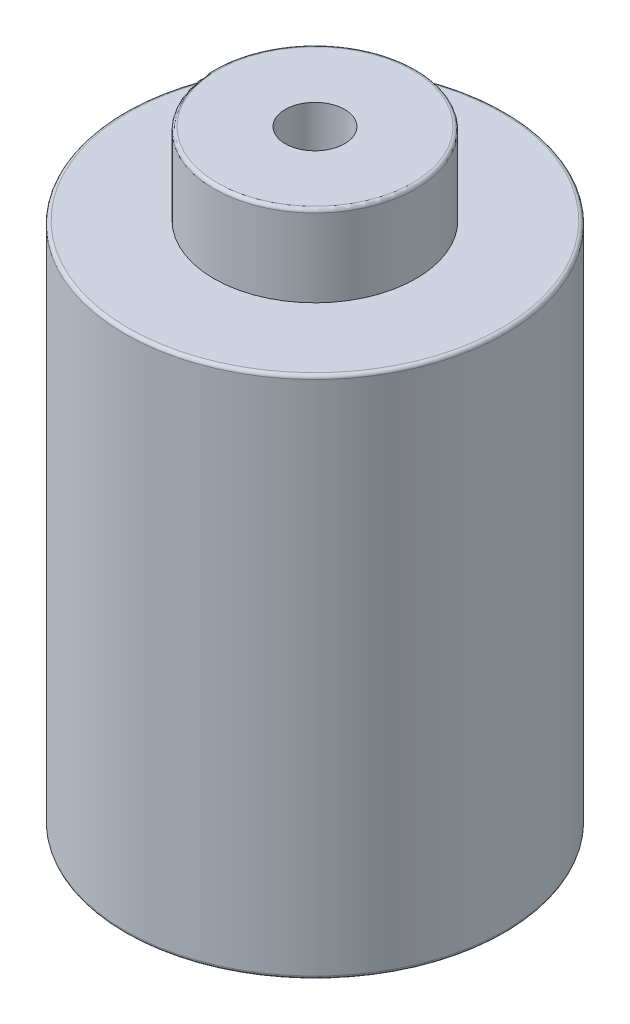
from build123d import *

# Parameters (mm, degrees)
SKETCH1_R           = 13.97
SKETCH1_R_2         = 2.1844
BOSS_EXTRUDE1_DEPTH = 44.45
CUT_EXTRUDE1_START  = -5.969
SKETCH2_R           = 13.97
SKETCH2_R_2         = 7.4295
CUT_EXTRUDE1_DEPTH  = 5.969
FILLET1_R           = 0.254


with BuildPart() as part:
    # Sketch1 → Boss-Extrude1 (new body)
    with BuildSketch(Plane(origin=(0, 0, 0), x_dir=(1, 0, 0), z_dir=(0, 1, 0))):
        with Locations(Location((0, 0, 0), (0, 0, 270))):
            Circle(SKETCH1_R)
        with Locations(Location((0, 0, 0), (0, 0, 270))):
            Circle(SKETCH1_R_2, mode=Mode.SUBTRACT)
    extrude(amount=BOSS_EXTRUDE1_DEPTH)

    # Sketch2 → Cut-Extrude1 (cut)
    with BuildSketch(Plane(origin=(0, 44.45, 0), x_dir=(1, 0, 0), z_dir=(0, 1, 0)).offset(CUT_EXTRUDE1_START)):
        with Locations(Location((0, 0, 0), (0, 0, 270))):
            Circle(SKETCH2_R)
        with Locations(Location((0, 0, 0), (0, 0, 270))):
            Circle(SKETCH2_R_2, mode=Mode.SUBTRACT)
    extrude(amount=CUT_EXTRUDE1_DEPTH, mode=Mode.SUBTRACT)

    # Fillet1
    fillet1_edges = [part.edges().sort_by_distance(p)[0] for p in [
        (0, 38.481, -13.97),
        (0, 44.45, -7.4295),
        (0, 0, -13.97),
    ]]
    fillet(fillet1_edges, radius=FILLET1_R)


solid = part.part
